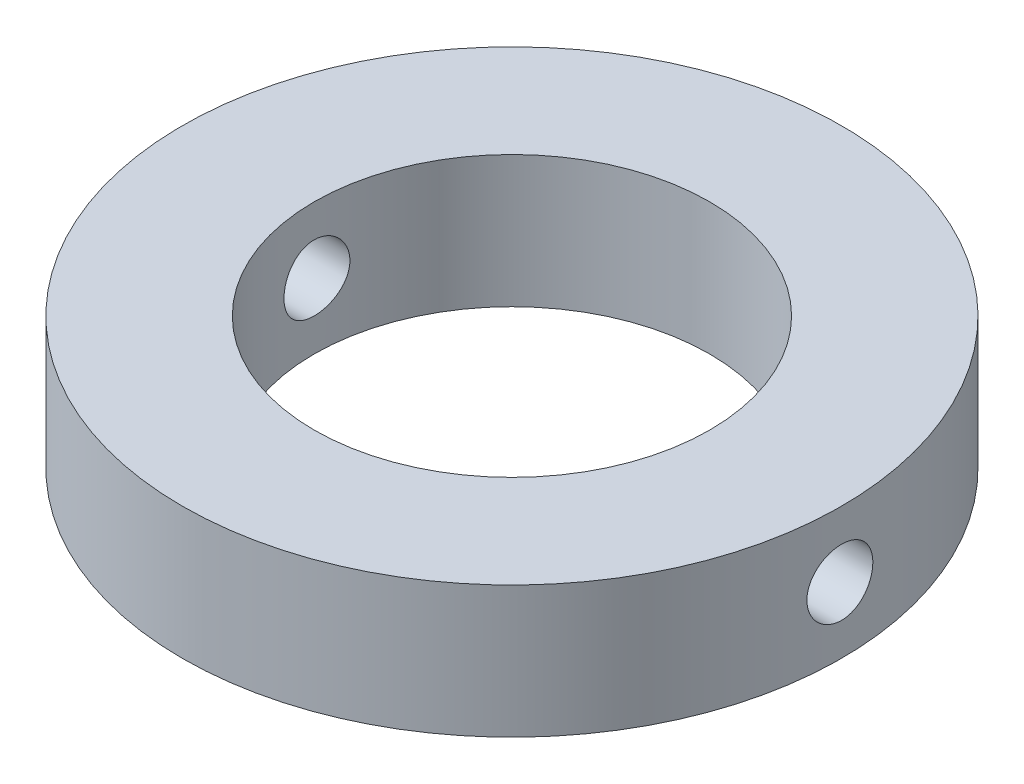
from build123d import *

# Parameters (mm, degrees)
SKETCH1_R           = 25
SKETCH1_R_2         = 15
BOSS_EXTRUDE1_DEPTH = 10
SKETCH2_R           = 2.5
CUT_EXTRUDE1_DEPTH  = 30


with BuildPart() as part:
    # Sketch1 → Boss-Extrude1 (new body)
    with BuildSketch(Plane(origin=(0, 0, 0), x_dir=(1, 0, 0), z_dir=(0, 1, 0))):
        with Locations(Location((0, 0, 0), (0, 0, 270))):
            Circle(SKETCH1_R)
        with Locations(Location((0, 0, 0), (0, 0, 270))):
            Circle(SKETCH1_R_2, mode=Mode.SUBTRACT)
    extrude(amount=BOSS_EXTRUDE1_DEPTH)

    # Sketch2 → Cut-Extrude1 (cut, symmetric)
    with BuildSketch(Plane(origin=(0, 0, 0), x_dir=(0, 0, -1), z_dir=(1, 0, 0))):
        with Locations((0, 5)):
            Circle(SKETCH2_R)
    extrude(amount=CUT_EXTRUDE1_DEPTH, both=True, mode=Mode.SUBTRACT)


solid = part.part
